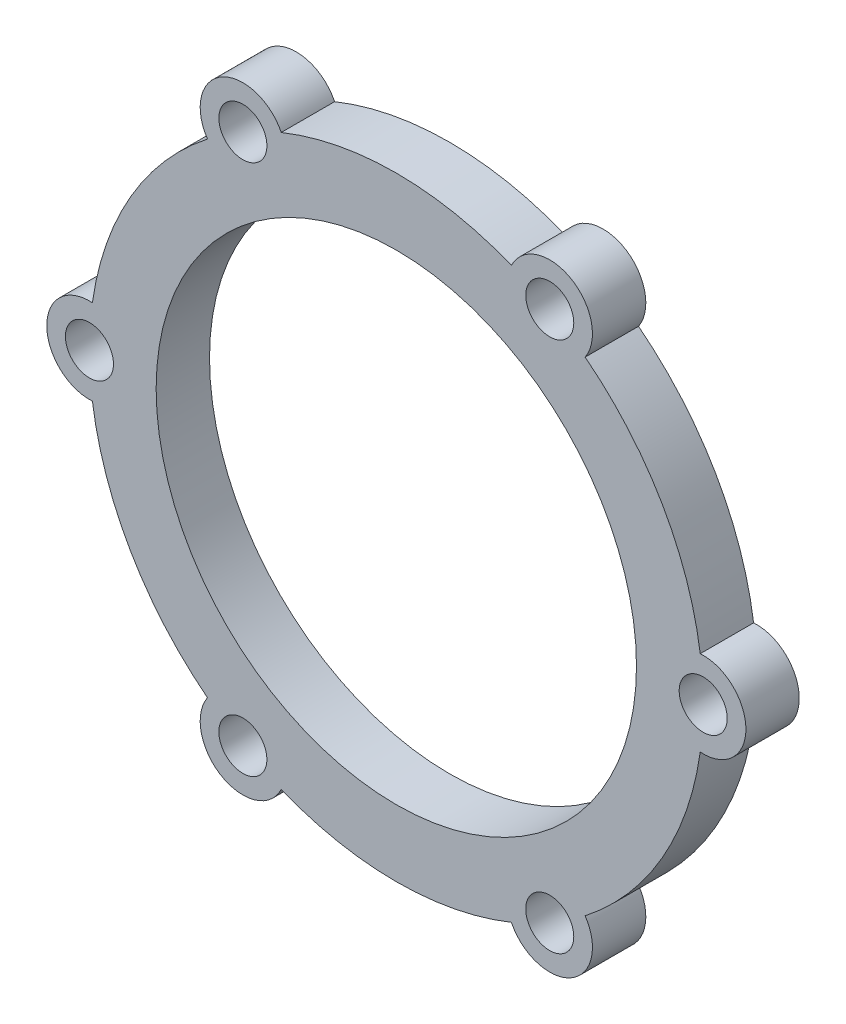
from build123d import *

# Parameters (mm, degrees)
SZKIC1_R                    = 4.5
SZKIC1_R_2                  = 45
DODANIE_WYCI_GNI_CIE1_DEPTH = 10


with BuildPart() as part:
    # Szkic1 → Dodanie-wyciągnięcie1 (new body)
    with BuildSketch(Plane.XY):
        with BuildLine():
            ThreePointArc((56.943478261, -7.980619246), (65.5, 0), (56.943478261, 7.980619246))
            ThreePointArc((56.943478261, 7.980619246), (49.796460718, 28.75), (35.383158136, 45.324189131))
            ThreePointArc((35.383158136, 45.324189131), (32.75, 56.724663948), (21.560320125, 53.304808377))
            ThreePointArc((21.560320125, 53.304808377), (0, 57.5), (-21.560320125, 53.304808377))
            ThreePointArc((-21.560320125, 53.304808377), (-32.75, 56.724663948), (-35.383158136, 45.324189131))
            ThreePointArc((-35.383158136, 45.324189131), (-49.796460718, 28.75), (-56.943478261, 7.980619246))
            ThreePointArc((-56.943478261, 7.980619246), (-65.5, 0), (-56.943478261, -7.980619246))
            ThreePointArc((-56.943478261, -7.980619246), (-49.796460718, -28.75), (-35.383158136, -45.324189131))
            ThreePointArc((-35.383158136, -45.324189131), (-32.75, -56.724663948), (-21.560320125, -53.304808377))
            ThreePointArc((-21.560320125, -53.304808377), (0, -57.5), (21.560320125, -53.304808377))
            ThreePointArc((21.560320125, -53.304808377), (32.75, -56.724663948), (35.383158136, -45.324189131))
            ThreePointArc((35.383158136, -45.324189131), (49.796460718, -28.75), (56.943478261, -7.980619246))
        make_face()
        with Locations((57.5, 0)):
            Circle(SZKIC1_R, mode=Mode.SUBTRACT)
        with Locations((-57.5, 0)):
            Circle(SZKIC1_R, mode=Mode.SUBTRACT)
        with Locations((-28.75, 49.796460718)):
            Circle(SZKIC1_R, mode=Mode.SUBTRACT)
        with Locations((28.75, 49.796460718)):
            Circle(SZKIC1_R, mode=Mode.SUBTRACT)
        Circle(SZKIC1_R_2, mode=Mode.SUBTRACT)
        with Locations((28.75, -49.796460718)):
            Circle(SZKIC1_R, mode=Mode.SUBTRACT)
        with Locations((-28.75, -49.796460718)):
            Circle(SZKIC1_R, mode=Mode.SUBTRACT)
    extrude(amount=DODANIE_WYCI_GNI_CIE1_DEPTH)


solid = part.part
